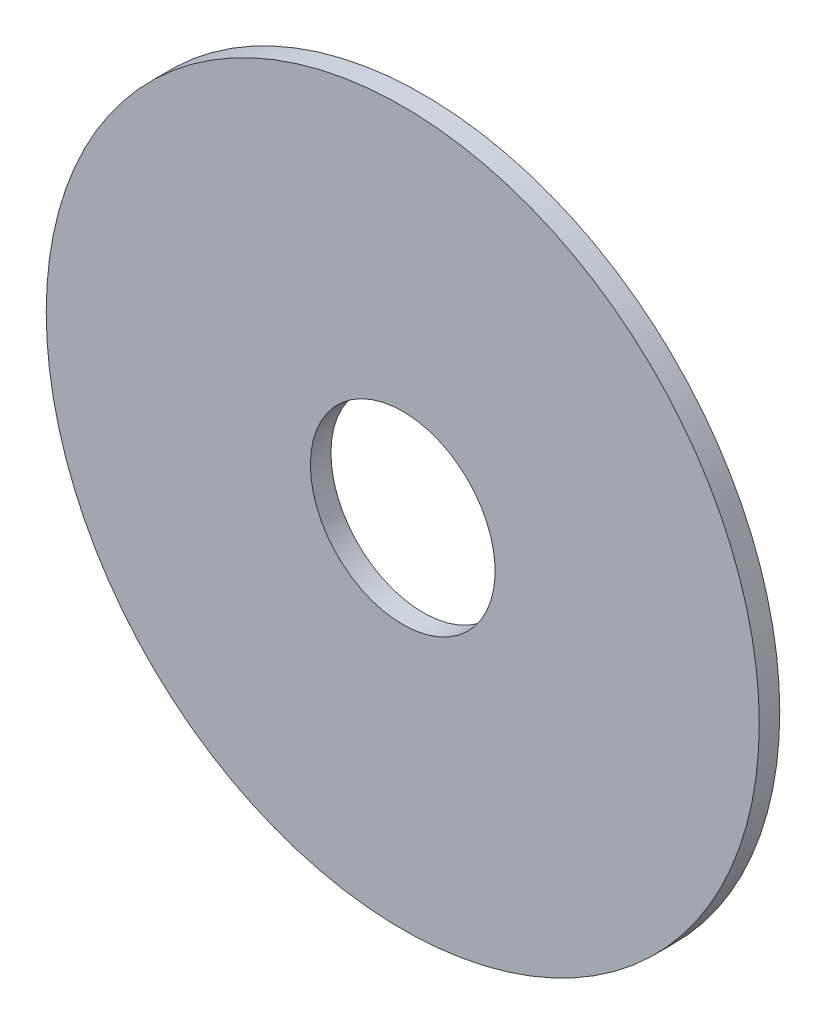
from build123d import *

# Parameters (mm, degrees)
SKETCH2_R           = 44.1325
BOSS_EXTRUDE1_DEPTH = 2.54
SKETCH3_R           = 11.43
CUT_EXTRUDE1_DEPTH  = 2.54


with BuildPart() as part:
    # Sketch2 → Boss-Extrude1 (new body)
    with BuildSketch(Plane.XY):
        Circle(SKETCH2_R)
    extrude(amount=BOSS_EXTRUDE1_DEPTH)

    # Sketch3 → Cut-Extrude1 (cut)
    with BuildSketch(Plane(origin=(0, 0, 0), x_dir=(-1, 0, 0), z_dir=(0, 0, -1))):
        Circle(SKETCH3_R)
    extrude(amount=-CUT_EXTRUDE1_DEPTH, mode=Mode.SUBTRACT)


solid = part.part
